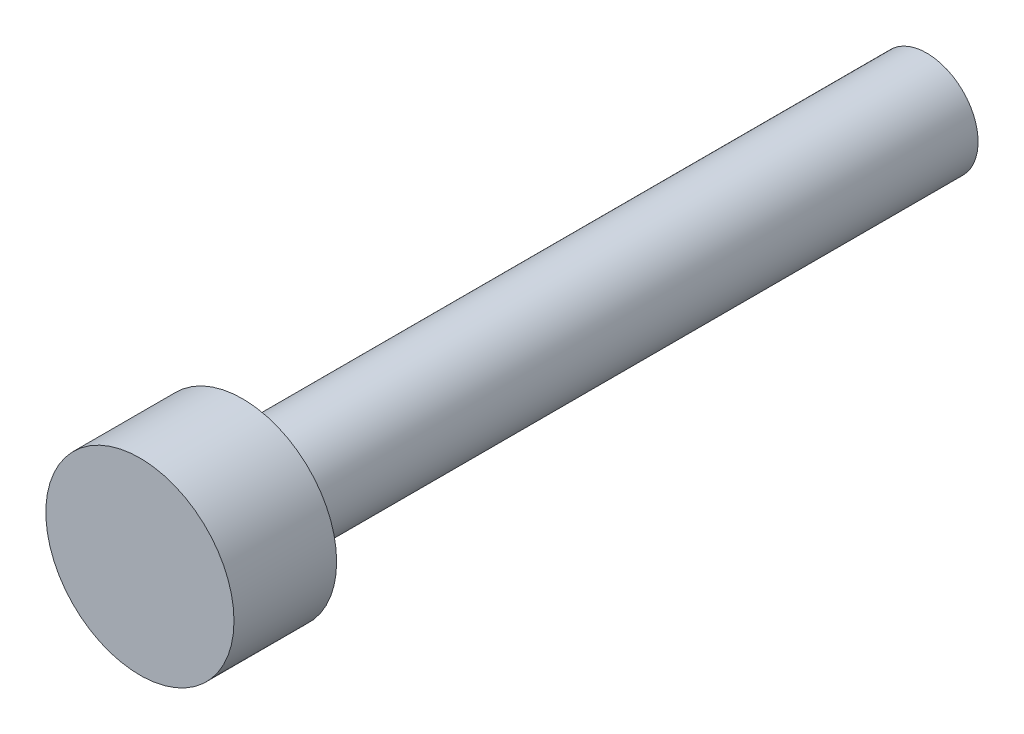
from build123d import *

# Parameters (mm, degrees)
SKETCH1_R           = 2.75
BOSS_EXTRUDE1_DEPTH = 3
SKETCH2_R           = 1.5
BOSS_EXTRUDE2_DEPTH = 20


with BuildPart() as part:
    # Sketch1 → Boss-Extrude1 (new body)
    with BuildSketch(Plane.XY):
        Circle(SKETCH1_R)
    extrude(amount=BOSS_EXTRUDE1_DEPTH)

    # Sketch2 → Boss-Extrude2 (add)
    with BuildSketch(Plane(origin=(0, 0, 0), x_dir=(-1, 0, 0), z_dir=(0, 0, -1))):
        Circle(SKETCH2_R)
    extrude(amount=BOSS_EXTRUDE2_DEPTH)


solid = part.part
